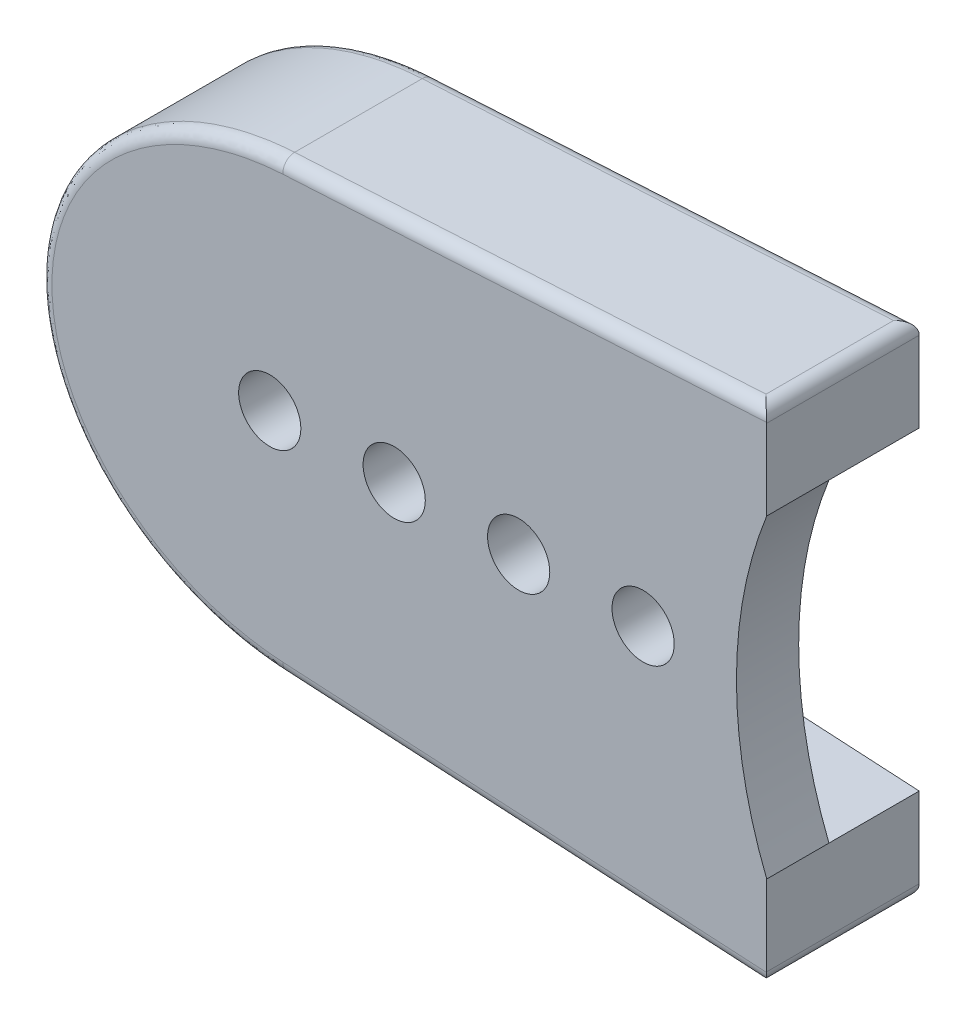
from build123d import *

# Parameters (mm, degrees)
SKETCH_1_R         = 0.5
EXTRUDE_1_DEPTH    = 1
EXTRUDE_START      = -2.45
EXTRUDE_2_DEPTH    = 2.45
EXTRUDE_1388_DEPTH = 2.45
FILLET_1_R         = 0.2


with BuildPart() as part:
    # 草图1 → 凸台-拉伸1 (new body)
    with BuildSketch(Plane.XY):
        with BuildLine():
            Line((-14.016792693, -2.096749739), (-6.313489141, -2.525837459))
            ThreePointArc((-6.313489141, -2.525837459), (-6.8, 0), (-6.313489141, 2.525837459))
            Line((-6.313489141, 2.525837459), (-14.016792693, 2.096749739))
            ThreePointArc((-14.016792693, 2.096749739), (-16, 0), (-14.016792693, -2.096749739))
        make_face()
        with Locations((-10.3, 0)):
            Circle(SKETCH_1_R, mode=Mode.SUBTRACT)
        with Locations((-14.3, 0)):
            Circle(SKETCH_1_R, mode=Mode.SUBTRACT)
        with Locations((-8.3, 0)):
            Circle(SKETCH_1_R, mode=Mode.SUBTRACT)
        with Locations((-12.3, 0)):
            Circle(SKETCH_1_R, mode=Mode.SUBTRACT)
    extrude(amount=EXTRUDE_1_DEPTH)

    # 草图3 → 凸台-拉伸2 (add)
    with BuildSketch(Plane.XY.offset(1).offset(EXTRUDE_START)):
        with BuildLine():
            Line((-6.313489141, 4.028162673), (-14.100216045, 3.594428124))
            ThreePointArc((-14.100216045, 3.594428124), (-17.5, 0), (-14.100216045, -3.594428124))
            Line((-14.100216045, -3.594428124), (-6.313489141, -4.028162673))
            Line((-6.313489141, -4.028162673), (-6.313489141, -2.525837459))
            Line((-6.313489141, -2.525837459), (-14.016792693, -2.096749739))
            ThreePointArc((-14.016792693, -2.096749739), (-16, 0), (-14.016792693, 2.096749739))
            Line((-14.016792693, 2.096749739), (-6.313489141, 2.525837459))
            Line((-6.313489141, 2.525837459), (-6.313489141, 4.028162673))
        make_face()
    extrude(amount=EXTRUDE_2_DEPTH)

    # 草图4 → Extrude 1388 (add)
    with BuildSketch(Plane.XY.offset(1).offset(EXTRUDE_START)):
        with BuildLine():
            ThreePointArc((-14.100216045, 3.594428124), (-17.5, 0), (-14.100216045, -3.594428124))
            add(Edge.make_bspline(
                [(-14.100216045, 3.594428124), (-18, 3.377203216), (-18, 0), (-18, -3.377203216), (-14.100216045, -3.594428124)],
                knots=[1.635161708, 1.635161708, 1.635161708, 3.141592654, 3.141592654, 4.6480236, 4.6480236, 4.6480236], degree=2, weights=[1, 0.729493299, 1, 0.729493299, 1]))
        make_face()
    extrude(amount=EXTRUDE_1388_DEPTH)

    # 圆角1
    fillet_1_edges = [part.edges().sort_by_distance(p)[0] for p in [
        (-10.206852593, 3.811295398, 1),
        (-10.206852593, -3.811295398, 1),
        (-10.206852593, -3.811295398, -1.45),
        (-6.313489141, -4.028162673, -0.225),
        (-6.313489141, 4.028162673, -0.225),
        (-10.206852593, 3.811295398, -1.45),
        (-18, 0, 1),
        (-18, 0, -1.45),
    ]]
    fillet(fillet_1_edges, radius=FILLET_1_R)


solid = part.part
